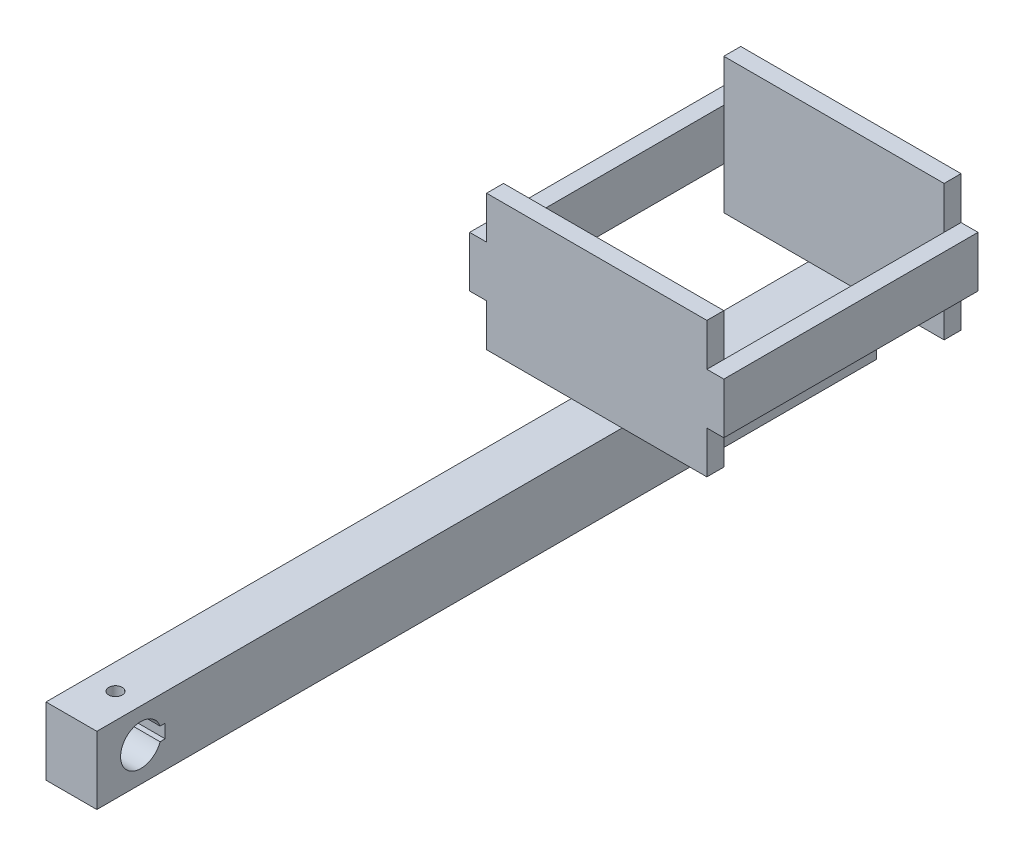
from build123d import *

# Parameters (mm, degrees)
SKETCH1_W            = 15
SKETCH1_H            = 20
BOSS_EXTRUDE1_DEPTH  = 230
SKETCH2_W            = 65
SKETCH2_H            = 40
BOSS_EXTRUDE6_DEPTH  = 5
SKETCH7_W            = 75
SKETCH7_H            = 15
BOSS_EXTRUDE7_DEPTH  = 5
SKETCH8_W            = 75
SKETCH8_H            = 15
BOSS_EXTRUDE8_DEPTH  = 5
SKETCH9_W            = 65
SKETCH9_H            = 40
BOSS_EXTRUDE11_DEPTH = 5
CUT_EXTRUDE1_DEPTH   = 240.635139326
SKETCH13_R           = 1.984375
CUT_EXTRUDE2_DEPTH   = 10


with BuildPart() as part:
    # Sketch1 → Boss-Extrude1 (new body)
    with BuildSketch(Plane.XY):
        Rectangle(SKETCH1_W, SKETCH1_H)
    extrude(amount=BOSS_EXTRUDE1_DEPTH)

    # Sketch2 → Boss-Extrude6 (add)
    with BuildSketch(Plane(origin=(0, 0, 0), x_dir=(-1, 0, 0), z_dir=(0, 0, -1))):
        with Locations((0, 30)):
            Rectangle(SKETCH2_W, SKETCH2_H)
    extrude(amount=-BOSS_EXTRUDE6_DEPTH)

    # Sketch7 → Boss-Extrude7 (add)
    with BuildSketch(Plane(origin=(32.5, 0, 0), x_dir=(0, 0, -1), z_dir=(1, 0, 0))):
        with Locations((-37.5, 30)):
            Rectangle(SKETCH7_W, SKETCH7_H)
    extrude(amount=BOSS_EXTRUDE7_DEPTH)

    # Sketch8 → Boss-Extrude8 (add)
    with BuildSketch(Plane.ZY.offset(32.5)):
        with Locations((37.5, 30)):
            Rectangle(SKETCH8_W, SKETCH8_H)
    extrude(amount=BOSS_EXTRUDE8_DEPTH)

    # Sketch9 → Boss-Extrude11 (add)
    with BuildSketch(Plane.XY.offset(75)):
        with Locations((0, 30)):
            Rectangle(SKETCH9_W, SKETCH9_H)
    extrude(amount=-BOSS_EXTRUDE11_DEPTH)

    # Sketch10 → Cut-Extrude1 (cut, through all)
    with BuildSketch(Plane.ZY.offset(7.5)):
        with BuildLine():
            Line((209.843145751, 2), (211.343145751, 2))
            ThreePointArc((211.343145751, 2), (223, 0), (211.343145751, -2))
            Line((211.343145751, -2), (209.843145751, -2))
            Line((209.843145751, -2), (209.843145751, 2))
        make_face()
    extrude(amount=-CUT_EXTRUDE1_DEPTH, mode=Mode.SUBTRACT)

    # Sketch13 → Cut-Extrude2 (cut)
    with BuildSketch(Plane(origin=(0, 10, 0), x_dir=(1, 0, 0), z_dir=(0, 1, 0))):
        with Locations(Location((0, -217, 0), (0, 0, 270))):
            Circle(SKETCH13_R)
    extrude(amount=-CUT_EXTRUDE2_DEPTH, mode=Mode.SUBTRACT)


solid = part.part
